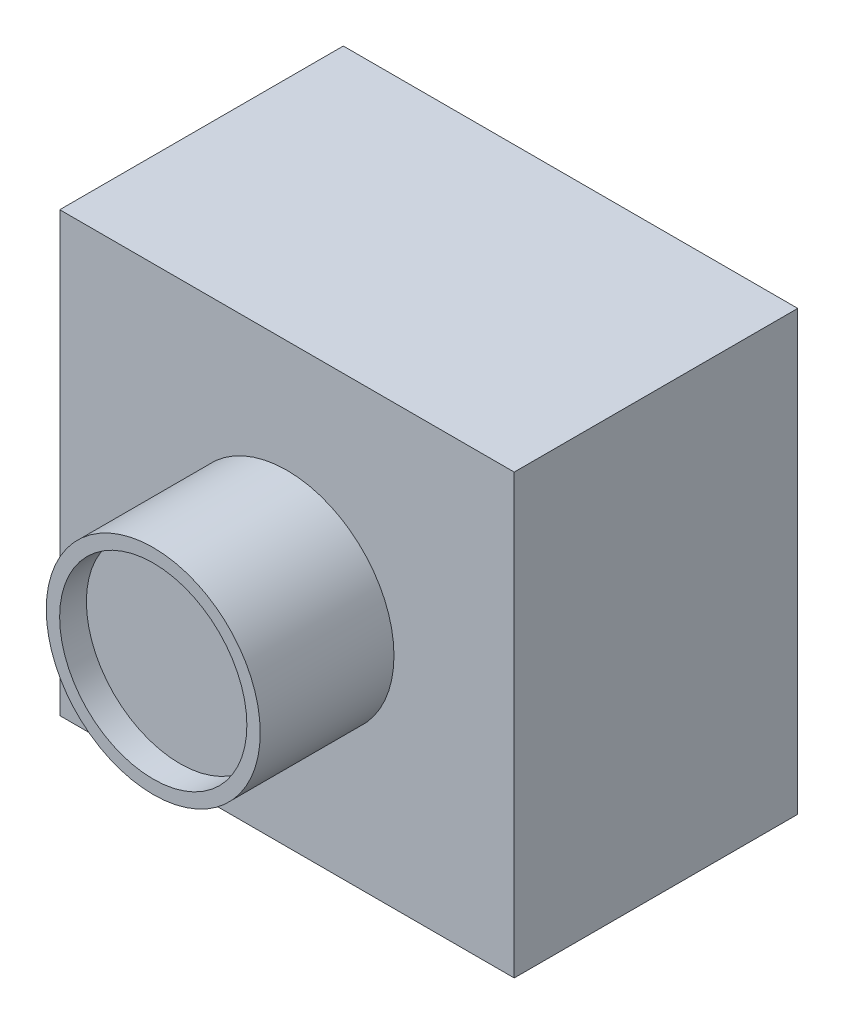
from build123d import *

# Parameters (mm, degrees)
ESTRUSIONE_ESTRUSIONE1_DEPTH      = 78
ESTRUSIONE_ESTRUSIONE1_DEPTH_BACK = 78
SCHIZZO1_W                        = 169.9
SCHIZZO1_H                        = 163.8
SCHIZZO2_W                        = 169.9
SCHIZZO2_H                        = 163.8
SCHIZZO2_R                        = 40
TAGLIO_ESTRUSIONE1_DEPTH          = 50
SCHIZZO3_R                        = 35
TAGLIO_ESTRUSIONE2_DEPTH          = 10


with BuildPart() as part:
    # Schizzo1 → Estrusione-Estrusione1 (new, two sides: drawn at the far end of the back side and taken through both)
    with BuildSketch(Plane.XY.offset(-ESTRUSIONE_ESTRUSIONE1_DEPTH_BACK)):
        Rectangle(SCHIZZO1_W, SCHIZZO1_H)
    extrude(amount=ESTRUSIONE_ESTRUSIONE1_DEPTH + ESTRUSIONE_ESTRUSIONE1_DEPTH_BACK)

    # Schizzo2 → Taglio-Estrusione1 (cut)
    with BuildSketch(Plane.XY.offset(78)):
        Rectangle(SCHIZZO2_W, SCHIZZO2_H)
        Circle(SCHIZZO2_R, mode=Mode.SUBTRACT)
    extrude(amount=-TAGLIO_ESTRUSIONE1_DEPTH, mode=Mode.SUBTRACT)

    # Schizzo3 → Taglio-Estrusione2 (cut)
    with BuildSketch(Plane.XY.offset(78)):
        Circle(SCHIZZO3_R)
    extrude(amount=-TAGLIO_ESTRUSIONE2_DEPTH, mode=Mode.SUBTRACT)


solid = part.part
